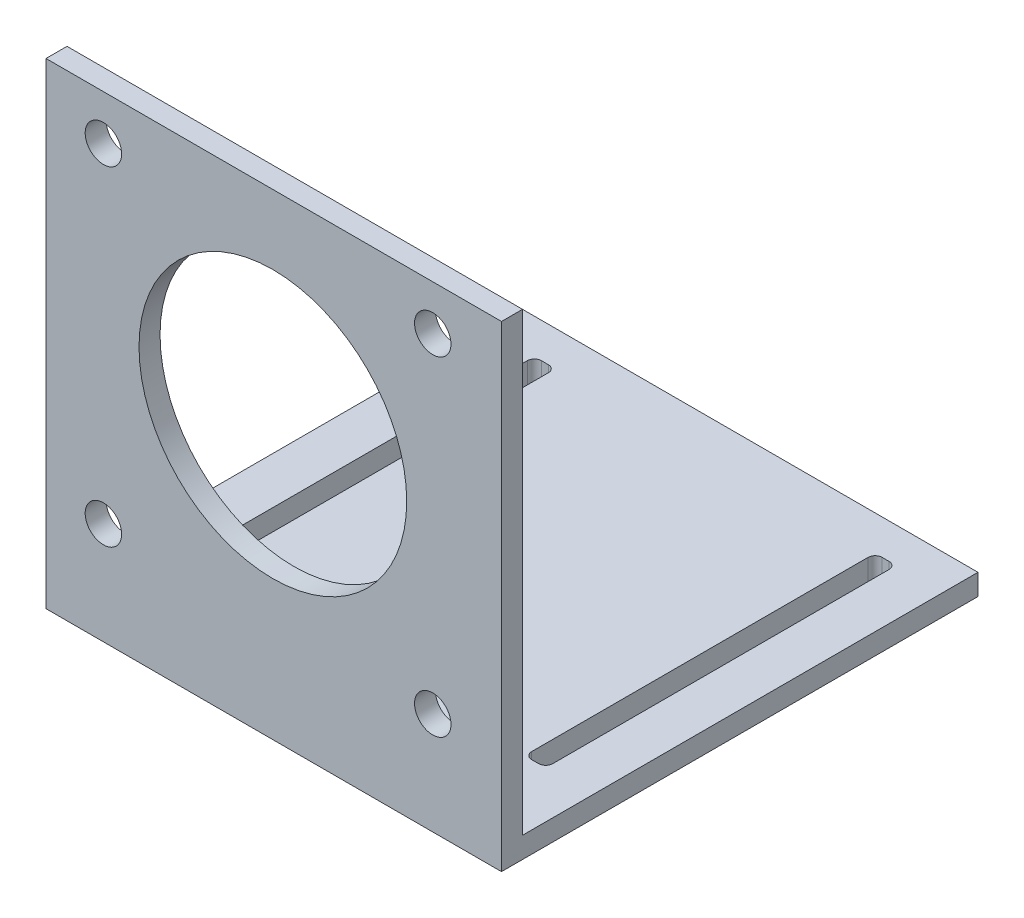
from build123d import *

# Parameters (mm, degrees)
EXTRUDE_1_DEPTH     = 65
SKETCH_2_R          = 19.1
SKETCH_2_R_2        = 2.6
CUT_EXTRUDE_1_DEPTH = 65
SKETCH_3_W          = 3
SKETCH_3_H          = 50
CUT_EXTRUDE_2_DEPTH = 10
FILLET_1_R          = 1


with BuildPart() as part:
    # 草图1 → 凸台-拉伸1 (new body)
    with BuildSketch(Plane(origin=(0, 0, 0), x_dir=(0, 0, -1), z_dir=(1, 0, 0))):
        Polygon((-6.706172895, 58.33487067), (-6.706172895, -9.66512933), (61.293827105, -9.66512933), (61.293827105, -6.66512933), (-3.706172895, -6.66512933), (-3.706172895, 58.33487067), align=None)
    extrude(amount=EXTRUDE_1_DEPTH)

    # 草图2 → 切除-拉伸1 (cut)
    with BuildSketch(Plane.XY.offset(6.706172895)):
        with Locations((32.374981494, 29.33487067)):
            Circle(SKETCH_2_R)
        with Locations((8.190858784, 51.925747661)):
            Circle(SKETCH_2_R_2)
        with Locations((55.190858784, 51.925747661)):
            Circle(SKETCH_2_R_2)
        with Locations((8.190858784, 4.925747661)):
            Circle(SKETCH_2_R_2)
        with Locations((55.190858784, 4.925747661)):
            Circle(SKETCH_2_R_2)
    extrude(amount=-CUT_EXTRUDE_1_DEPTH, mode=Mode.SUBTRACT)

    # 草图3 → 切除-拉伸2 (cut)
    with BuildSketch(Plane(origin=(0, -6.66512933, 0), x_dir=(1, 0, 0), z_dir=(0, 1, 0))):
        with Locations((8.19, 31.293827105)):
            Rectangle(SKETCH_3_W, SKETCH_3_H)
        with Locations((56.81, 31.293827105)):
            Rectangle(SKETCH_3_W, SKETCH_3_H)
    extrude(amount=-CUT_EXTRUDE_2_DEPTH, mode=Mode.SUBTRACT)

    # 圆角1
    fillet_1_edges = [part.edges().sort_by_distance(p)[0] for p in [
        (6.69, -8.16512933, -6.293827105),
        (6.69, -8.16512933, -56.293827105),
        (9.69, -8.16512933, -56.293827105),
        (9.69, -8.16512933, -6.293827105),
        (55.31, -8.16512933, -6.293827105),
        (55.31, -8.16512933, -56.293827105),
        (58.31, -8.16512933, -56.293827105),
        (58.31, -8.16512933, -6.293827105),
    ]]
    fillet(fillet_1_edges, radius=FILLET_1_R)


solid = part.part
